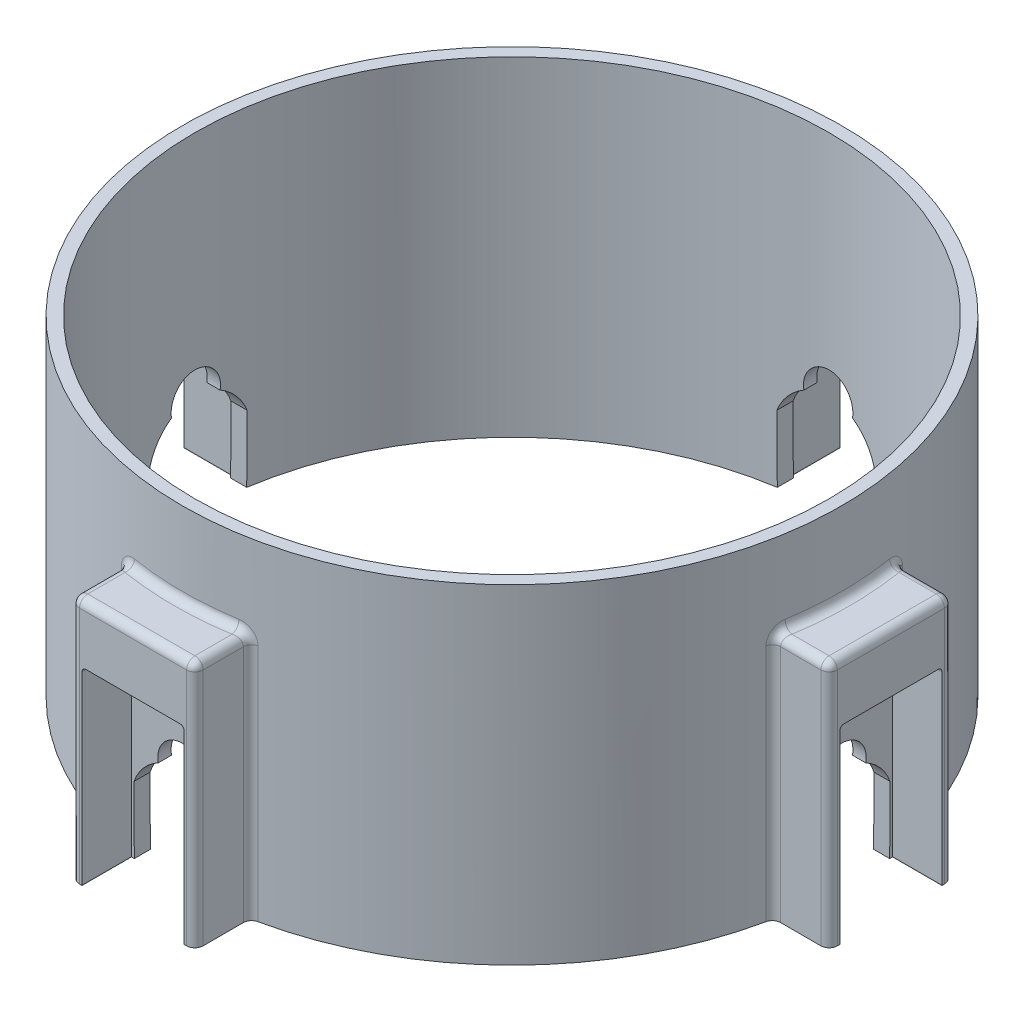
from build123d import *

# Parameters (mm, degrees)
SKETCH1_R                = 40
SKETCH1_R_2              = 38.5
BOSS_EXTRUDE1_DEPTH      = 40
BOSS_EXTRUDE2_START      = -0.709416
SKETCH2_W                = 15
SKETCH2_H                = 30
BOSS_EXTRUDE2_DEPTH      = 6.709416
CUT_EXTRUDE1_DEPTH       = 2
CUT_EXTRUDE2_DEPTH       = 98.979589752
CUT_EXTRUDE3_DEPTH       = 3.1
FILLET1_R                = 1
CIRPATTERN1_COUNT        = 4
FILLET1_OF_CIRPATTERN1_R = 1


with BuildPart() as part:
    # Sketch1 → Boss-Extrude1 (new body)
    with BuildSketch(Plane(origin=(0, 0, 0), x_dir=(1, 0, 0), z_dir=(0, 1, 0))):
        with Locations(Location((0, 0, 0), (0, 0, 270))):
            Circle(SKETCH1_R)
        with Locations(Location((0, 0, 0), (0, 0, 270))):
            Circle(SKETCH1_R_2, mode=Mode.SUBTRACT)
    extrude(amount=BOSS_EXTRUDE1_DEPTH)

    # Sketch2 → Boss-Extrude2 (add)
    with BuildSketch(Plane.XY.offset(40).offset(BOSS_EXTRUDE2_START)):
        with Locations((0, 15)):
            Rectangle(SKETCH2_W, SKETCH2_H)
    boss_extrude2 = extrude(amount=BOSS_EXTRUDE2_DEPTH)

    # Sketch3 → Cut-Extrude1 (cut)
    with BuildSketch(Plane.XY.offset(40)):
        with BuildLine():
            Line((5.888429752, 8.094968987), (5.849089405, -0.140625902))
            Line((5.849089405, -0.140625902), (-5.849089405, -0.140625902))
            Line((-5.849089405, -0.140625902), (-5.888429752, 8.094968987))
            ThreePointArc((-5.888429752, 8.094968987), (-4.737957384, 10.07605935), (-2.950909049, 11.509504132))
            ThreePointArc((-2.950909049, 11.509504132), (0, 15.05), (2.950909049, 11.509504132))
            ThreePointArc((2.950909049, 11.509504132), (4.737957384, 10.07605935), (5.888429752, 8.094968987))
        make_face()
    cut_extrude1 = extrude(amount=-CUT_EXTRUDE1_DEPTH, mode=Mode.SUBTRACT)

    # Sketch4 → Cut-Extrude2 (cut, through all)
    with BuildSketch(Plane.XY.offset(40)):
        with BuildLine():
            Line((-5.7, -0.45), (5.7, -0.45))
            ThreePointArc((5.7, -0.45), (6.053553391, -0.303553391), (6.2, 0.05))
            Line((6.2, 0.05), (6.2, 22.45))
            ThreePointArc((6.2, 22.45), (6.053553391, 22.803553391), (5.7, 22.95))
            Line((5.7, 22.95), (-5.7, 22.95))
            ThreePointArc((-5.7, 22.95), (-6.053553391, 22.803553391), (-6.2, 22.45))
            Line((-6.2, 22.45), (-6.2, 0.05))
            ThreePointArc((-6.2, 0.05), (-6.053553391, -0.303553391), (-5.7, -0.45))
        make_face()
    cut_extrude2 = extrude(amount=CUT_EXTRUDE2_DEPTH, mode=Mode.SUBTRACT)

    # Sketch5 → Cut-Extrude3 (cut)
    with BuildSketch(Plane.XY.offset(41.5)):
        with BuildLine():
            Line((-0.3, 25.966025404), (0.3, 25.966025404))
            Line((0.3, 25.966025404), (0.3, 27.05))
            ThreePointArc((0.3, 27.05), (0.446446609, 27.403553391), (0.8, 27.55))
            Line((0.8, 27.55), (5.7, 27.55))
            ThreePointArc((5.7, 27.55), (6.053553391, 27.403553391), (6.2, 27.05))
            Line((6.2, 27.05), (6.2, 22.85))
            Line((6.2, 22.85), (5.7, 22.85))
            Line((5.7, 22.85), (-5.7, 22.85))
            Line((-5.7, 22.85), (-6.2, 22.85))
            Line((-6.2, 22.85), (-6.2, 27.05))
            ThreePointArc((-6.2, 27.05), (-6.053553391, 27.403553391), (-5.7, 27.55))
            Line((-5.7, 27.55), (-0.8, 27.55))
            ThreePointArc((-0.8, 27.55), (-0.446446609, 27.403553391), (-0.3, 27.05))
            Line((-0.3, 27.05), (-0.3, 25.966025404))
        make_face()
    cut_extrude3 = extrude(amount=CUT_EXTRUDE3_DEPTH, mode=Mode.SUBTRACT)

    # Fillet1
    fillet1_edges = [part.edges().sort_by_distance(p)[0] for p in [
        (7.5, 15, 39.290584),
        (7.5, 30, 42.645292),
        (3.766738351, 30, 39.822251094),
        (-7.5, 30, 42.645292),
        (-7.5, 15, 39.290584),
        (7.5, 15, 46),
        (0, 30, 46),
        (-7.5, 15, 46),
    ]]
    fillet(fillet1_edges, radius=FILLET1_R)

    # CirPattern1: Boss-Extrude2, Cut-Extrude1, Cut-Extrude2, Cut-Extrude3 ×4 about axis
    cirpattern1_axis = Axis((0, 0, 0), (0, 1, 0))
    add([boss_extrude2.rotate(cirpattern1_axis, i * 360 / CIRPATTERN1_COUNT) for i in range(1, CIRPATTERN1_COUNT)])
    add([cut_extrude1.rotate(cirpattern1_axis, i * 360 / CIRPATTERN1_COUNT) for i in range(1, CIRPATTERN1_COUNT)], mode=Mode.SUBTRACT)
    add([cut_extrude2.rotate(cirpattern1_axis, i * 360 / CIRPATTERN1_COUNT) for i in range(1, CIRPATTERN1_COUNT)], mode=Mode.SUBTRACT)
    add([cut_extrude3.rotate(cirpattern1_axis, i * 360 / CIRPATTERN1_COUNT) for i in range(1, CIRPATTERN1_COUNT)], mode=Mode.SUBTRACT)

    # Fillet1 of CirPattern1
    fillet1_of_cirpattern1_edges = [part.edges().sort_by_distance(p)[0] for p in [
        (39.290584, 15, -7.5),
        (42.645292, 30, -7.5),
        (39.822251094, 30, -3.766738351),
        (42.645292, 30, 7.5),
        (39.290584, 15, 7.5),
        (46, 15, -7.5),
        (46, 30, 0),
        (46, 15, 7.5),
        (-7.5, 15, -39.290584),
        (-7.5, 30, -42.645292),
        (-3.766738351, 30, -39.822251094),
        (7.5, 30, -42.645292),
        (7.5, 15, -39.290584),
        (-7.5, 15, -46),
        (0, 30, -46),
        (7.5, 15, -46),
        (-39.290584, 15, 7.5),
        (-42.645292, 30, 7.5),
        (-39.822251094, 30, 3.766738351),
        (-42.645292, 30, -7.5),
        (-39.290584, 15, -7.5),
        (-46, 15, 7.5),
        (-46, 30, 0),
        (-46, 15, -7.5),
    ]]
    fillet(fillet1_of_cirpattern1_edges, radius=FILLET1_OF_CIRPATTERN1_R)


solid = part.part
